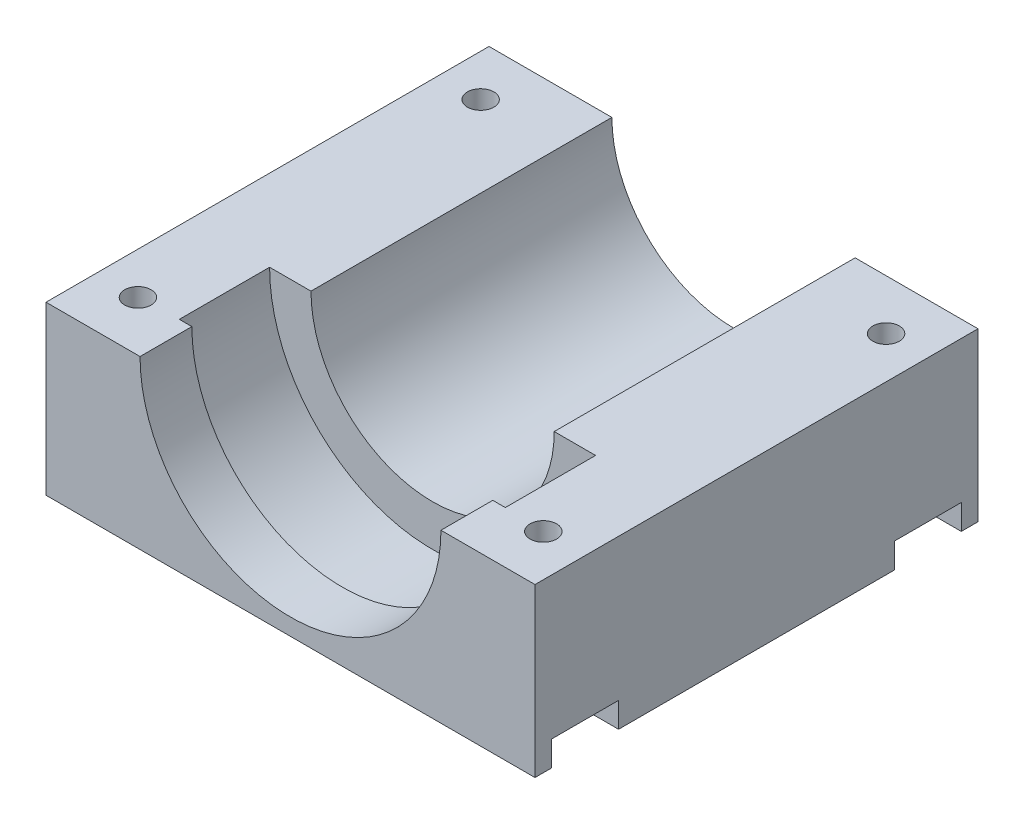
from build123d import *

# Parameters (mm, degrees)
SKETCH1_W                                  = 58.5
SKETCH1_H                                  = 20
BOSS_EXTRUDE1_DEPTH                        = 53
CUT_EXTRUDE2_DEPTH                         = 17
CUT_EXTRUDE3_DEPTH                         = 42.5
SKETCH8_W                                  = 10
SKETCH8_H                                  = 8
CUT_EXTRUDE6_DEPTH                         = 3
SKETCH7_R                                  = 1.585
CUT_EXTRUDE5_DEPTH                         = 92.5
MIRROR1_AT_THE_SECOND_PLANE_COPY_1_SKETC_W = 10
MIRROR1_AT_THE_SECOND_PLANE_COPY_1_SKETC_H = 8
MIRROR1_AT_THE_SECOND_PLANE_COPY_1_DEPTH   = 3
CUT_EXTRUDE7_DEPTH                         = 10.8


with BuildPart() as part:
    # Sketch1 → Boss-Extrude1 (new body)
    with BuildSketch(Plane.XY):
        with Locations((29.25, -3.609195402)):
            Rectangle(SKETCH1_W, SKETCH1_H)
    extrude(amount=BOSS_EXTRUDE1_DEPTH)

    # Sketch3 → Cut-Extrude2 (cut)
    with BuildSketch(Plane.XY.offset(53)):
        with BuildLine():
            Line((11.25, 6.390804598), (47.25, 6.390804598))
            ThreePointArc((47.25, 6.390804598), (29.25, -11.609195402), (11.25, 6.390804598))
        make_face()
    extrude(amount=-CUT_EXTRUDE2_DEPTH, mode=Mode.SUBTRACT)

    # Sketch5 → Cut-Extrude3 (cut)
    with BuildSketch(Plane(origin=(0, 0, 0), x_dir=(-1, 0, 0), z_dir=(0, 0, -1))):
        with BuildLine():
            Line((-43.8, 6.390804598), (-14.7, 6.390804598))
            ThreePointArc((-14.7, 6.390804598), (-29.25, -8.159195402), (-43.8, 6.390804598))
        make_face()
    extrude(amount=-CUT_EXTRUDE3_DEPTH, mode=Mode.SUBTRACT)

    # Sketch8 → Cut-Extrude6 (cut)
    with BuildSketch(Plane(origin=(0, -13.609195402, 0), x_dir=(-1, 0, 0), z_dir=(0, -1, 0))):
        with Locations((-53.5, -6)):
            Rectangle(SKETCH8_W, SKETCH8_H)
    cut_extrude6 = extrude(amount=-CUT_EXTRUDE6_DEPTH, mode=Mode.SUBTRACT)

    # Sketch7 → Cut-Extrude5 (cut)
    with BuildSketch(Plane(origin=(0, -13.609195402, 0), x_dir=(-1, 0, 0), z_dir=(0, -1, 0))):
        with Locations(Location((-53.5, -47, 0), (0, 0, 180))):
            Circle(SKETCH7_R)
        with Locations(Location((-53.5, -6, 0), (0, 0, 180))):
            Circle(SKETCH7_R)
        with Locations(Location((-5, -6, 0), (0, 0, 180))):
            Circle(SKETCH7_R)
        with Locations(Location((-5, -47, 0), (0, 0, 180))):
            Circle(SKETCH7_R)
    extrude(amount=-CUT_EXTRUDE5_DEPTH, mode=Mode.SUBTRACT)

    # Mirror1: Cut-Extrude6 across plane
    add(cut_extrude6.mirror(Plane.XY.offset(26.5)), mode=Mode.SUBTRACT)

    # Mirror1 at the second plane: Cut-Extrude6 across plane
    add(cut_extrude6.mirror(Plane.ZY.offset(-29.25)), mode=Mode.SUBTRACT)

    # Mirror1 at the second plane copy 1 sketc → Mirror1 at the second plane copy 1 (cut)
    with BuildSketch(Plane(origin=(58.5, -13.609195402, 53), x_dir=(1, 0, 0), z_dir=(0, -1, 0))):
        with Locations((-53.5, -6)):
            Rectangle(MIRROR1_AT_THE_SECOND_PLANE_COPY_1_SKETC_W, MIRROR1_AT_THE_SECOND_PLANE_COPY_1_SKETC_H)
    extrude(amount=-MIRROR1_AT_THE_SECOND_PLANE_COPY_1_DEPTH, mode=Mode.SUBTRACT)

    # Sketch11 → Cut-Extrude7 (cut)
    with BuildSketch(Plane.XY.offset(36)):
        with BuildLine():
            Line((9.75, 6.390804598), (48.75, 6.390804598))
            ThreePointArc((48.75, 6.390804598), (29.25, -13.109195402), (9.75, 6.390804598))
        make_face()
    extrude(amount=CUT_EXTRUDE7_DEPTH, mode=Mode.SUBTRACT)


solid = part.part
